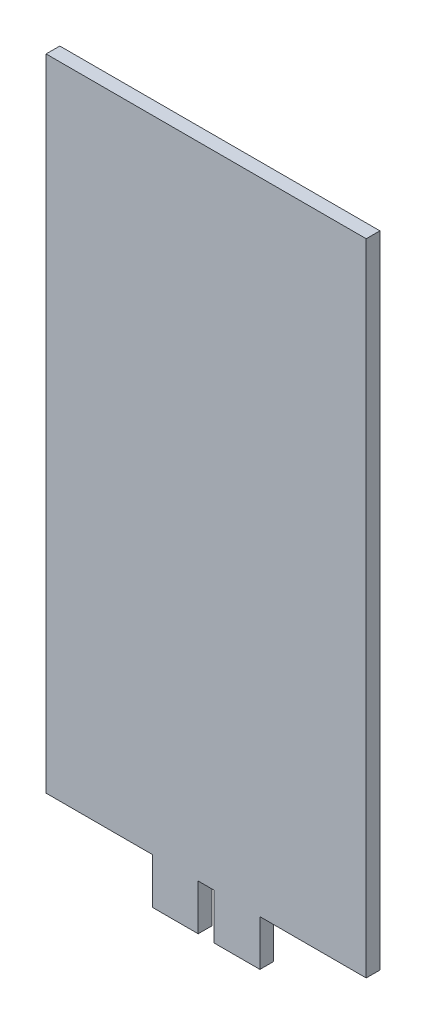
from build123d import *

# Parameters (mm, degrees)
SKIZZE1_W                       = 35
SKIZZE1_H                       = 75
AUFSATZ_LINEAR_AUSTRAGEN1_DEPTH = 1.5
SKIZZE2_W                       = 11.63
SKIZZE2_H                       = 5
SKIZZE2_W_2                     = 11.62
SKIZZE2_W_3                     = 1.75
SCHNITT_LINEAR_AUSTRAGEN1_DEPTH = 1.5


with BuildPart() as part:
    # Skizze1 → Aufsatz-Linear austragen1 (new body)
    with BuildSketch(Plane.XY):
        with Locations((17.5, 37.5)):
            Rectangle(SKIZZE1_W, SKIZZE1_H)
    extrude(amount=AUFSATZ_LINEAR_AUSTRAGEN1_DEPTH)

    # Skizze2 → Schnitt-Linear austragen1 (cut)
    with BuildSketch(Plane.XY.offset(1.5)):
        with Locations((5.815, 2.5)):
            Rectangle(SKIZZE2_W, SKIZZE2_H)
        with Locations((29.19, 2.5)):
            Rectangle(SKIZZE2_W_2, SKIZZE2_H)
        with Locations((17.505, 2.5)):
            Rectangle(SKIZZE2_W_3, SKIZZE2_H)
    extrude(amount=-SCHNITT_LINEAR_AUSTRAGEN1_DEPTH, mode=Mode.SUBTRACT)


solid = part.part
